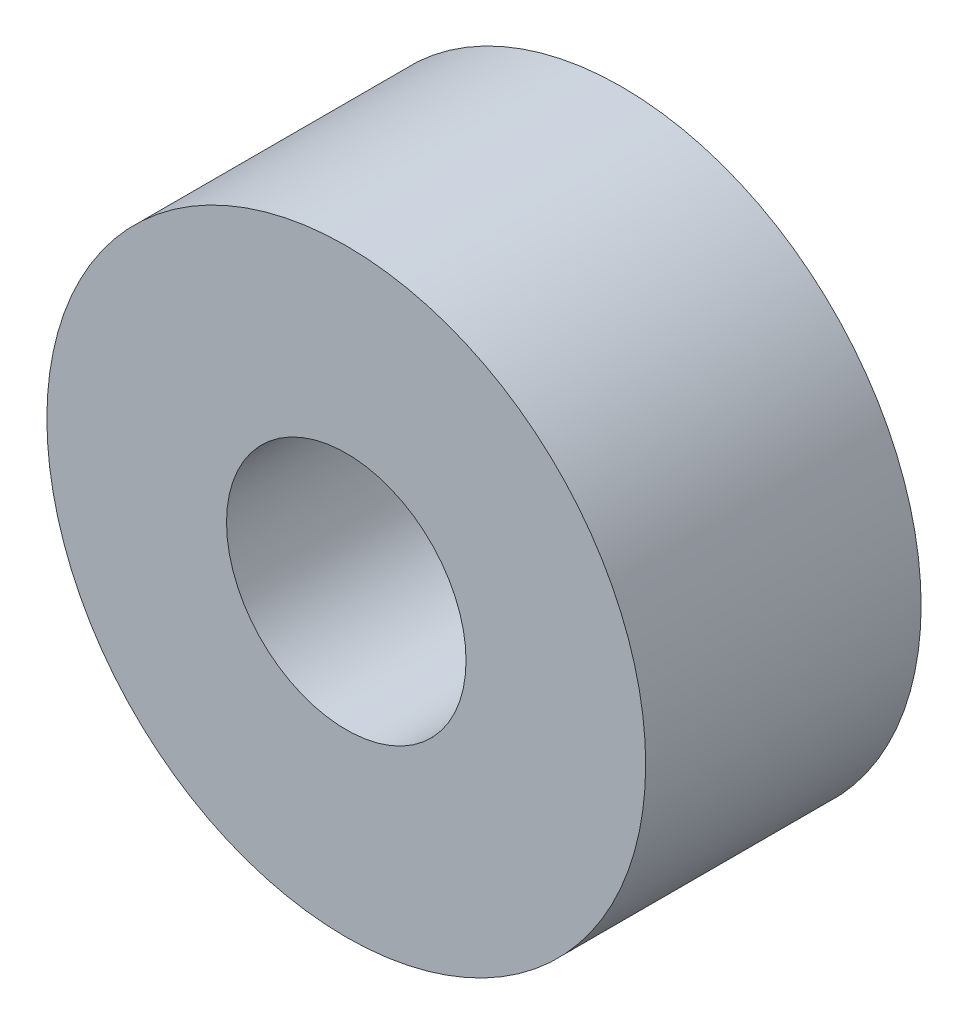
from build123d import *

# Parameters (mm, degrees)
SKETCH_1_R      = 2.5
SKETCH_1_R_2    = 1
EXTRUDE_1_DEPTH = 2.3


with BuildPart() as part:
    # 草图1 → 凸台-拉伸1 (new body)
    with BuildSketch(Plane.XY):
        Circle(SKETCH_1_R)
        Circle(SKETCH_1_R_2, mode=Mode.SUBTRACT)
    extrude(amount=EXTRUDE_1_DEPTH)


solid = part.part
